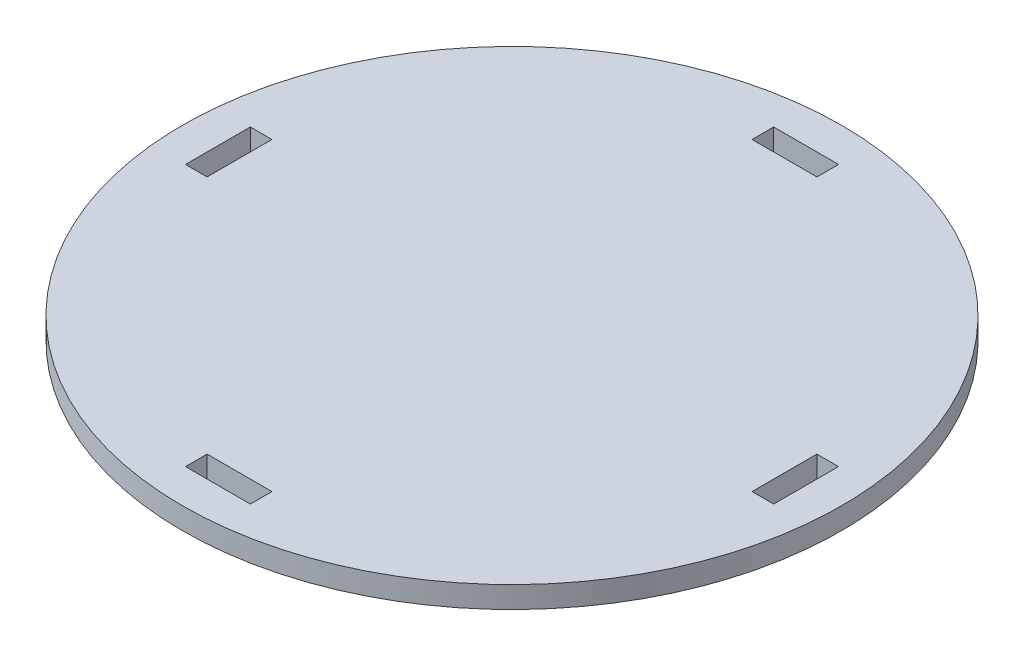
from build123d import *

# Parameters (mm, degrees)
SKETCH1_R           = 76.2
SKETCH1_W           = 15
SKETCH1_H           = 5
SKETCH1_W_2         = 5
SKETCH1_H_2         = 15
BOSS_EXTRUDE1_DEPTH = 5


with BuildPart() as part:
    # Sketch1 → Boss-Extrude1 (new body)
    with BuildSketch(Plane(origin=(0, 0, 0), x_dir=(1, 0, 0), z_dir=(0, 1, 0))):
        with Locations(Location((0, 0, 0), (0, 0, 270))):
            Circle(SKETCH1_R)
        with Locations((0, 65.5)):
            Rectangle(SKETCH1_W, SKETCH1_H, mode=Mode.SUBTRACT)
        with Locations((-65.5, 0)):
            Rectangle(SKETCH1_W_2, SKETCH1_H_2, mode=Mode.SUBTRACT)
        with Locations((65.5, 0)):
            Rectangle(SKETCH1_W_2, SKETCH1_H_2, mode=Mode.SUBTRACT)
        with Locations((0, -65.5)):
            Rectangle(SKETCH1_W, SKETCH1_H, mode=Mode.SUBTRACT)
    extrude(amount=BOSS_EXTRUDE1_DEPTH)


solid = part.part
